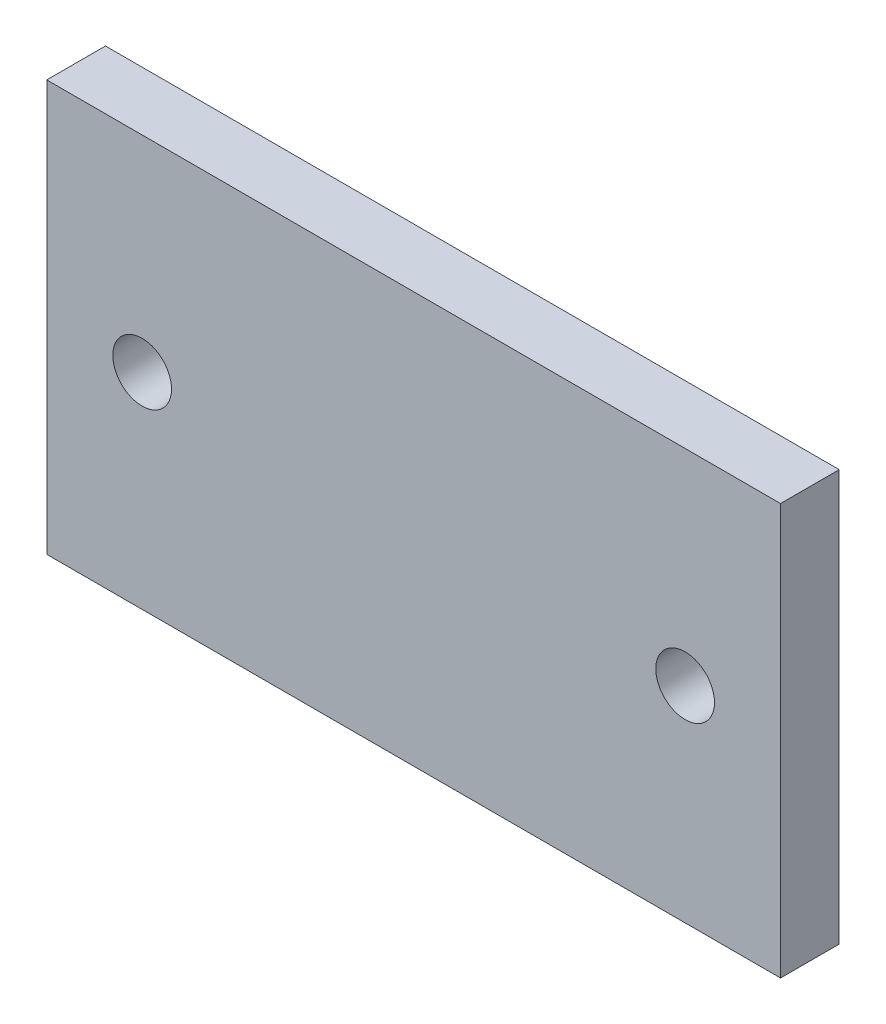
from build123d import *

# Parameters (mm, degrees)
SKETCH1_W           = 250
SKETCH1_H           = 140
SKETCH1_R           = 10
BOSS_EXTRUDE1_DEPTH = 20


with BuildPart() as part:
    # Sketch1 → Boss-Extrude1 (new body)
    with BuildSketch(Plane.XY):
        with Locations((-17.5330033, -26.064356436)):
            Rectangle(SKETCH1_W, SKETCH1_H)
        with Locations((74.9669967, -26.064356436)):
            Circle(SKETCH1_R, mode=Mode.SUBTRACT)
        with Locations((-110.0330033, -26.064356436)):
            Circle(SKETCH1_R, mode=Mode.SUBTRACT)
    extrude(amount=BOSS_EXTRUDE1_DEPTH)


solid = part.part
